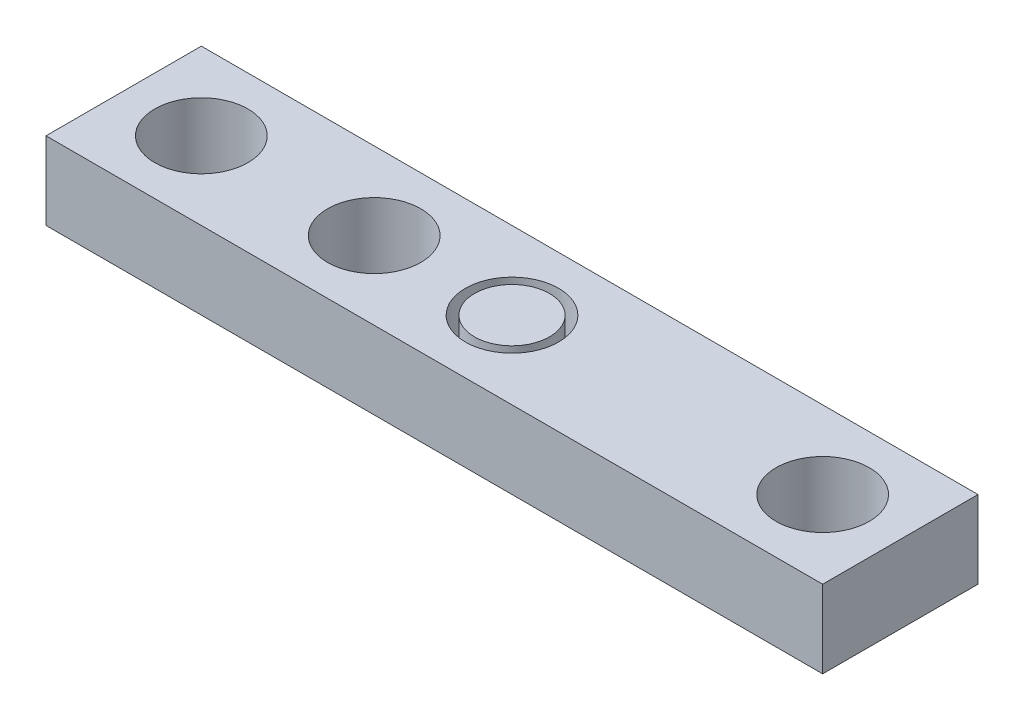
from build123d import *

# Parameters (mm, degrees)
SKETCH1_W           = 50
SKETCH1_H           = 10
SKETCH1_R           = 3
BOSS_EXTRUDE1_DEPTH = 2.5
SKETCH2_R           = 3
CUT_EXTRUDE1_DEPTH  = 26.980762114
SKETCH3_R           = 3
CUT_EXTRUDE2_DEPTH  = 26.980762114
SKETCH4_R           = 2.417633123
BOSS_EXTRUDE3_DEPTH = 5


with BuildPart() as part:
    # Sketch1 → Boss-Extrude1 (new, symmetric)
    with BuildSketch(Plane(origin=(0, 0, 0), x_dir=(1, 0, 0), z_dir=(0, 1, 0))):
        Rectangle(SKETCH1_W, SKETCH1_H)
        with Locations(Location((-20, 0, 0), (0, 0, 270))):
            Circle(SKETCH1_R, mode=Mode.SUBTRACT)
        with Locations(Location((20, 0, 0), (0, 0, 270))):
            Circle(SKETCH1_R, mode=Mode.SUBTRACT)
    extrude(amount=BOSS_EXTRUDE1_DEPTH, both=True)

    # Sketch2 → Cut-Extrude1 (cut, through all)
    with BuildSketch(Plane(origin=(0, 2.5, 0), x_dir=(1, 0, 0), z_dir=(0, 1, 0))):
        with Locations(Location((0, 0, 0), (0, 0, 270))):
            Circle(SKETCH2_R)
    extrude(amount=-CUT_EXTRUDE1_DEPTH, mode=Mode.SUBTRACT)

    # Sketch3 → Cut-Extrude2 (cut, through all)
    with BuildSketch(Plane(origin=(0, 2.5, 0), x_dir=(1, 0, 0), z_dir=(0, 1, 0))):
        with Locations(Location((-8.871229838, 0, 0), (0, 0, 270))):
            Circle(SKETCH3_R)
    extrude(amount=-CUT_EXTRUDE2_DEPTH, mode=Mode.SUBTRACT)


with BuildPart() as body_2:
    # Sketch4 → Boss-Extrude3 (new, through all)
    with BuildSketch(Plane(origin=(0, 2.5, 0), x_dir=(1, 0, 0), z_dir=(0, 1, 0))):
        with Locations(Location((0, 0, 0), (0, 0, 270))):
            Circle(SKETCH4_R)
    extrude(amount=-BOSS_EXTRUDE3_DEPTH)


solid = Compound([part.part, body_2.part])
